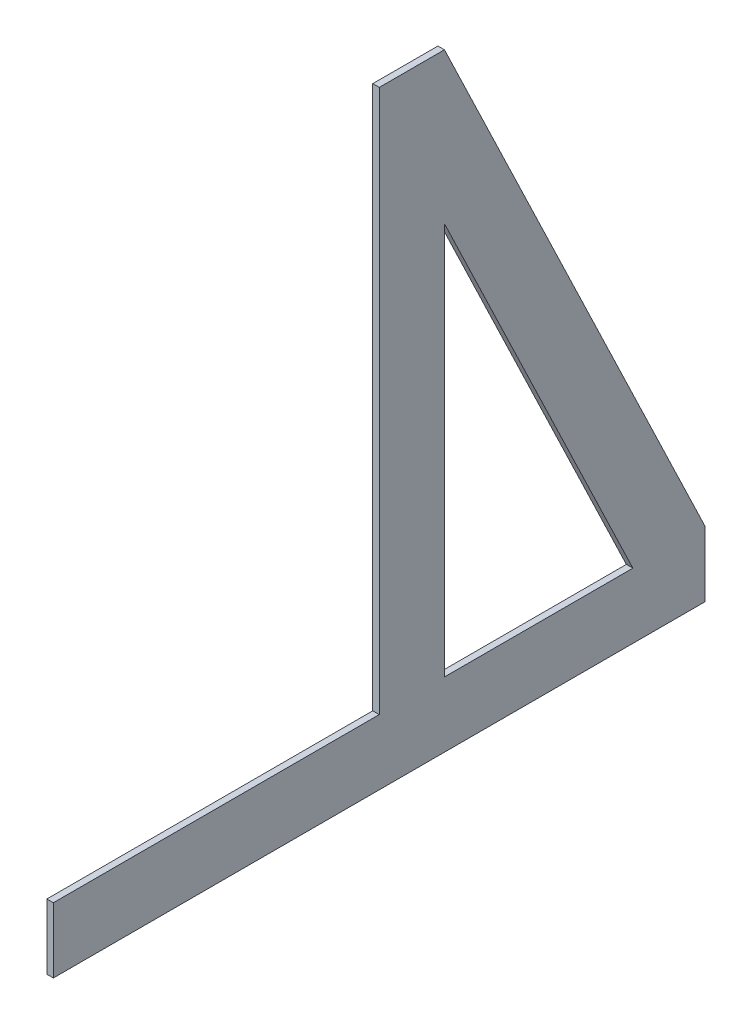
from build123d import *

# Parameters (mm, degrees)
EXTRUDE_500_DEPTH = 6


with BuildPart() as part:
    # Sketch 492 → Extrude 500 (new body)
    with BuildSketch(Plane(origin=(0, 0, 0), x_dir=(0, 0, -1), z_dir=(1, 0, 0))):
        Polygon((-593.846153846, -224.461538462), (6.153846154, -224.461538462), (6.153846154, -164.461538462), (-233.846153846, 335.538461538), (-293.846153846, 335.538461538), (-293.846153846, -164.461538462), (-593.846153846, -164.461538462), align=None)
        Polygon((-233.846153846, -164.461538462), (-60.400192041, -164.461538462), (-233.846153846, 196.8842153), align=None, mode=Mode.SUBTRACT)
    extrude(amount=EXTRUDE_500_DEPTH)


solid = part.part
